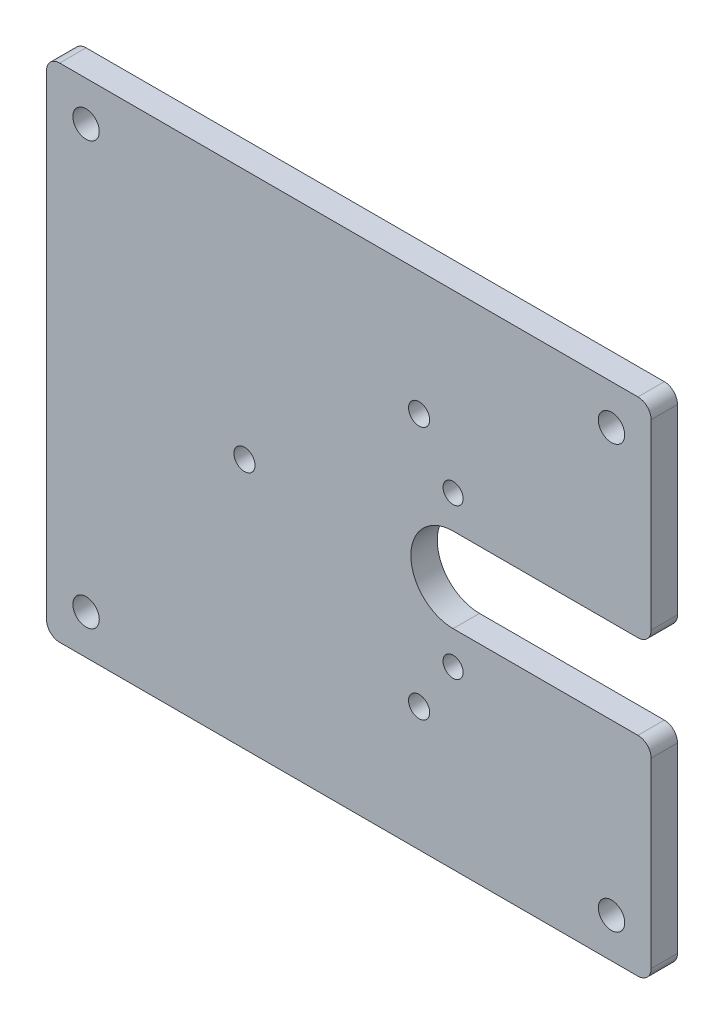
from build123d import *

# Parameters (mm, degrees)
SKETCH1_R           = 2
SKETCH1_R_2         = 1.9
SKETCH1_R_3         = 2.5
BOSS_EXTRUDE1_DEPTH = 5


with BuildPart() as part:
    # Sketch1 → Boss-Extrude1 (new body)
    with BuildSketch(Plane.XY):
        with BuildLine():
            Line((-55, 45), (-55, -45))
            ThreePointArc((-55, -45), (-54.267766953, -46.767766953), (-52.5, -47.5))
            Line((-52.5, -47.5), (57, -47.5))
            ThreePointArc((57, -47.5), (58.767766953, -46.767766953), (59.5, -45))
            Line((59.5, -45), (59.5, -10.5))
            ThreePointArc((59.5, -10.5), (58.767766953, -8.732233047), (57, -8))
            Line((57, -8), (22, -8))
            ThreePointArc((22, -8), (14, 0), (22, 8))
            Line((22, 8), (57, 8))
            ThreePointArc((57, 8), (58.767766953, 8.732233047), (59.5, 10.5))
            Line((59.5, 10.5), (59.5, 45))
            ThreePointArc((59.5, 45), (58.767766953, 46.767766953), (57, 47.5))
            Line((57, 47.5), (-52.5, 47.5))
            ThreePointArc((-52.5, 47.5), (-54.267766953, 46.767766953), (-55, 45))
        make_face()
        with Locations(Location((15.562803405, 24, 0), (0, 0, 180))):
            Circle(SKETCH1_R, mode=Mode.SUBTRACT)
        with Locations((22, -14.25)):
            Circle(SKETCH1_R_2, mode=Mode.SUBTRACT)
        with Locations(Location((22, 14.25, 0), (0, 0, 180))):
            Circle(SKETCH1_R_2, mode=Mode.SUBTRACT)
        with Locations((52, -40)):
            Circle(SKETCH1_R_3, mode=Mode.SUBTRACT)
        with Locations((-47.5, -40)):
            Circle(SKETCH1_R_3, mode=Mode.SUBTRACT)
        with Locations((15.562803405, -24)):
            Circle(SKETCH1_R, mode=Mode.SUBTRACT)
        with Locations((-17.5, 0)):
            Circle(SKETCH1_R, mode=Mode.SUBTRACT)
        with Locations(Location((-47.5, 40, 0), (0, 0, 180))):
            Circle(SKETCH1_R_3, mode=Mode.SUBTRACT)
        with Locations(Location((52, 40, 0), (0, 0, 180))):
            Circle(SKETCH1_R_3, mode=Mode.SUBTRACT)
    extrude(amount=BOSS_EXTRUDE1_DEPTH)


solid = part.part
